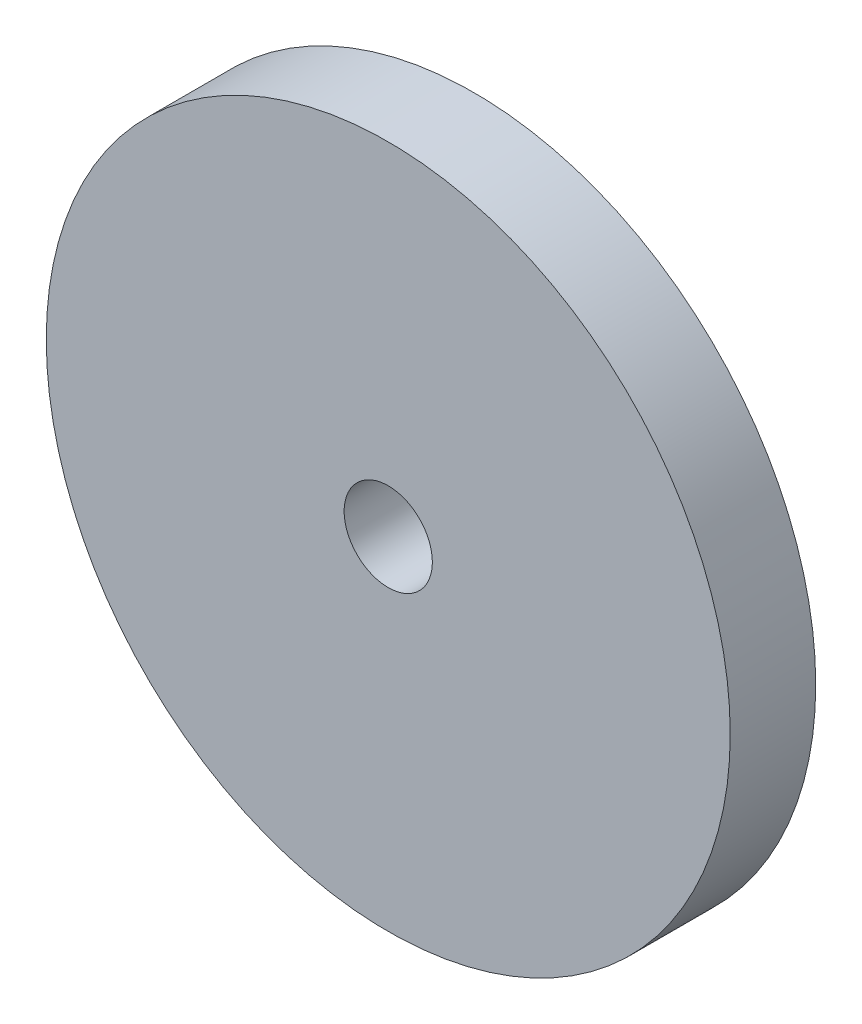
from build123d import *

# Parameters (mm, degrees)
SKETCH2_R           = 25.4
SKETCH2_R_2         = 3.2766
BOSS_EXTRUDE1_DEPTH = 6.35


with BuildPart() as part:
    # Sketch2 → Boss-Extrude1 (new body)
    with BuildSketch(Plane.XY):
        Circle(SKETCH2_R)
        Circle(SKETCH2_R_2, mode=Mode.SUBTRACT)
    extrude(amount=BOSS_EXTRUDE1_DEPTH)


solid = part.part
